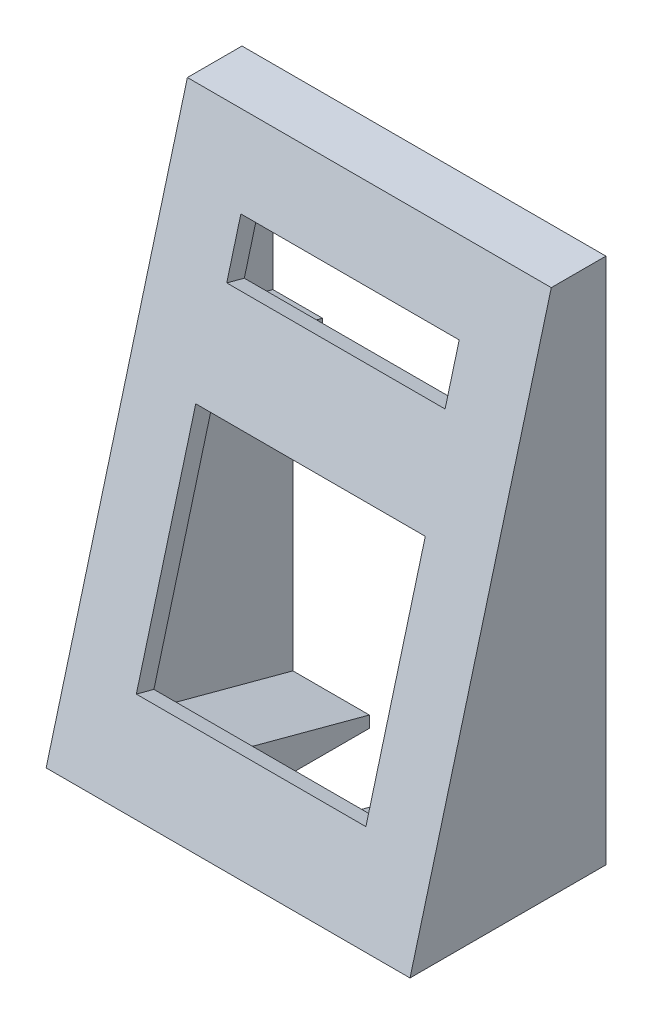
from build123d import *

# Parameters (mm, degrees)
BOSS_EXTRUDE1_DEPTH = 50
SKETCH5_W           = 15
SKETCH5_H           = 144.888873943
BOSS_EXTRUDE2_DEPTH = 50
SKETCH3_W           = 63.082028678
SKETCH3_H           = 63.082028678
SKETCH3_W_2         = 60
SKETCH3_H_2         = 15
CUT_EXTRUDE1_DEPTH  = 153.964709483
CUT_EXTRUDE2_START  = -5
SKETCH4_W           = 75
SKETCH4_H           = 27
CUT_EXTRUDE2_DEPTH  = 148.964709483
CUT_EXTRUDE3_START  = -14
SKETCH6_W           = 83
SKETCH6_H           = 40
CUT_EXTRUDE3_DEPTH  = 100
SKETCH7_R           = 1.5
CUT_EXTRUDE4_DEPTH  = 10
SKETCH8_W           = 55.690082514
SKETCH8_H           = 14
CUT_EXTRUDE5_DEPTH  = 153.277751166


with BuildPart() as part:
    # Sketch1 → Boss-Extrude1 (new, symmetric)
    with BuildSketch(Plane(origin=(0, 0, 0), x_dir=(0, 0, -1), z_dir=(1, 0, 0))):
        Polygon((0, 0), (0, 144.888873943), (-38.822856765, 0), align=None)
    extrude(amount=BOSS_EXTRUDE1_DEPTH, both=True)

    # Sketch5 → Boss-Extrude2 (add, symmetric)
    with BuildSketch(Plane(origin=(0, 0, 0), x_dir=(0, 0, -1), z_dir=(1, 0, 0))):
        with Locations((7.5, 72.444436972)):
            Rectangle(SKETCH5_W, SKETCH5_H)
    extrude(amount=BOSS_EXTRUDE2_DEPTH, both=True)

    # Sketch3 → Cut-Extrude1 (cut, through all)
    with BuildSketch(Plane(origin=(0, 9.705714191, 36.222218486), x_dir=(1, 0, 0), z_dir=(0, 0.25881904510251436, 0.96592582628907))):
        with Locations((0, 45.951905284)):
            Rectangle(SKETCH3_W, SKETCH3_H)
        with Locations((0, 111.951905284)):
            Rectangle(SKETCH3_W_2, SKETCH3_H_2)
    extrude(amount=-CUT_EXTRUDE1_DEPTH, mode=Mode.SUBTRACT)

    # Sketch4 → Cut-Extrude2 (cut, through all)
    with BuildSketch(Plane(origin=(0, 9.705714191, 36.222218486), x_dir=(1, 0, 0), z_dir=(0, 0.25881904510251436, 0.96592582628907)).offset(CUT_EXTRUDE2_START)):
        Polygon((-36, 84.951905284), (36, 84.951905284), (36, 6.951905284), (15, 6.951905284), (15, -5.048094716), (-15, -5.048094716), (-15, 6.951905284), (-36, 6.951905284), align=None)
        with Locations((0, 111.951905284)):
            Rectangle(SKETCH4_W, SKETCH4_H)
    extrude(amount=-CUT_EXTRUDE2_DEPTH, mode=Mode.SUBTRACT)

    # Sketch6 → Cut-Extrude3 (cut)
    with BuildSketch(Plane(origin=(0, 9.705714191, 36.222218486), x_dir=(1, 0, 0), z_dir=(0, 0.25881904510251436, 0.96592582628907)).offset(CUT_EXTRUDE3_START)):
        with Locations((0, 111.951905284)):
            Rectangle(SKETCH6_W, SKETCH6_H)
    extrude(amount=-CUT_EXTRUDE3_DEPTH, mode=Mode.SUBTRACT)

    # Sketch7 → Cut-Extrude4 (cut)
    with BuildSketch(Plane(origin=(0, 6.08224756, 22.699256918), x_dir=(-1, 0, 0), z_dir=(0, -0.25881904510251436, -0.96592582628907))):
        with Locations(Location((37.5, 127.451905284, 0), (0, 0, 90))):
            Circle(SKETCH7_R)
        with Locations(Location((-37.5, 127.451905284, 0), (0, 0, 270))):
            Circle(SKETCH7_R)
        with Locations(Location((37.5, 96.451905284, 0), (0, 0, 270))):
            Circle(SKETCH7_R)
        with Locations(Location((-37.5, 96.451905284, 0), (0, 0, 90))):
            Circle(SKETCH7_R)
    extrude(amount=-CUT_EXTRUDE4_DEPTH, mode=Mode.SUBTRACT)

    # Sketch8 → Cut-Extrude5 (cut, through all)
    with BuildSketch(Plane(origin=(0, 6.08224756, 22.699256918), x_dir=(-1, 0, 0), z_dir=(0, -0.25881904510251436, -0.96592582628907))):
        with Locations((0, 91.951905284)):
            Rectangle(SKETCH8_W, SKETCH8_H)
    extrude(amount=CUT_EXTRUDE5_DEPTH, mode=Mode.SUBTRACT)


solid = part.part
